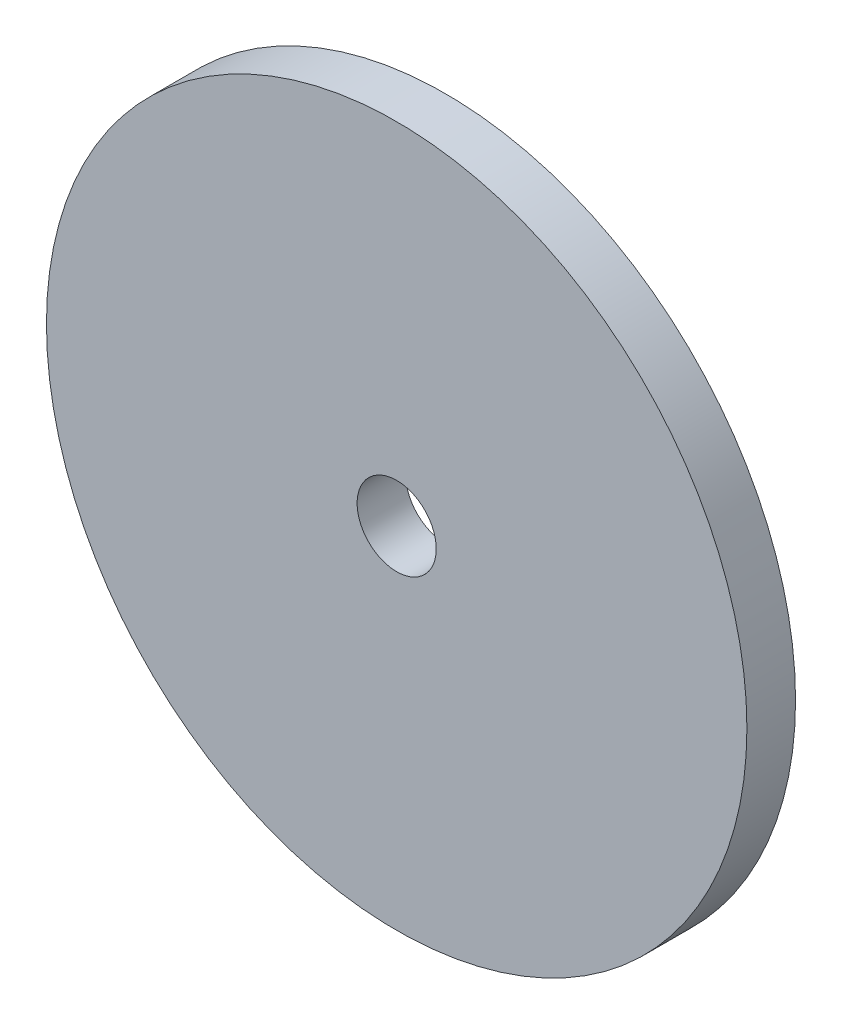
from build123d import *

# Parameters (mm, degrees)
SKETCH1_R           = 22.86
SKETCH1_R_2         = 2.5828
BOSS_EXTRUDE1_DEPTH = 3.175


with BuildPart() as part:
    # Sketch1 → Boss-Extrude1 (new body)
    with BuildSketch(Plane.XY):
        with Locations((-72.334844907, 41.077558686)):
            Circle(SKETCH1_R)
        with Locations((-72.334844907, 41.077558686)):
            Circle(SKETCH1_R_2, mode=Mode.SUBTRACT)
    extrude(amount=BOSS_EXTRUDE1_DEPTH)


solid = part.part
